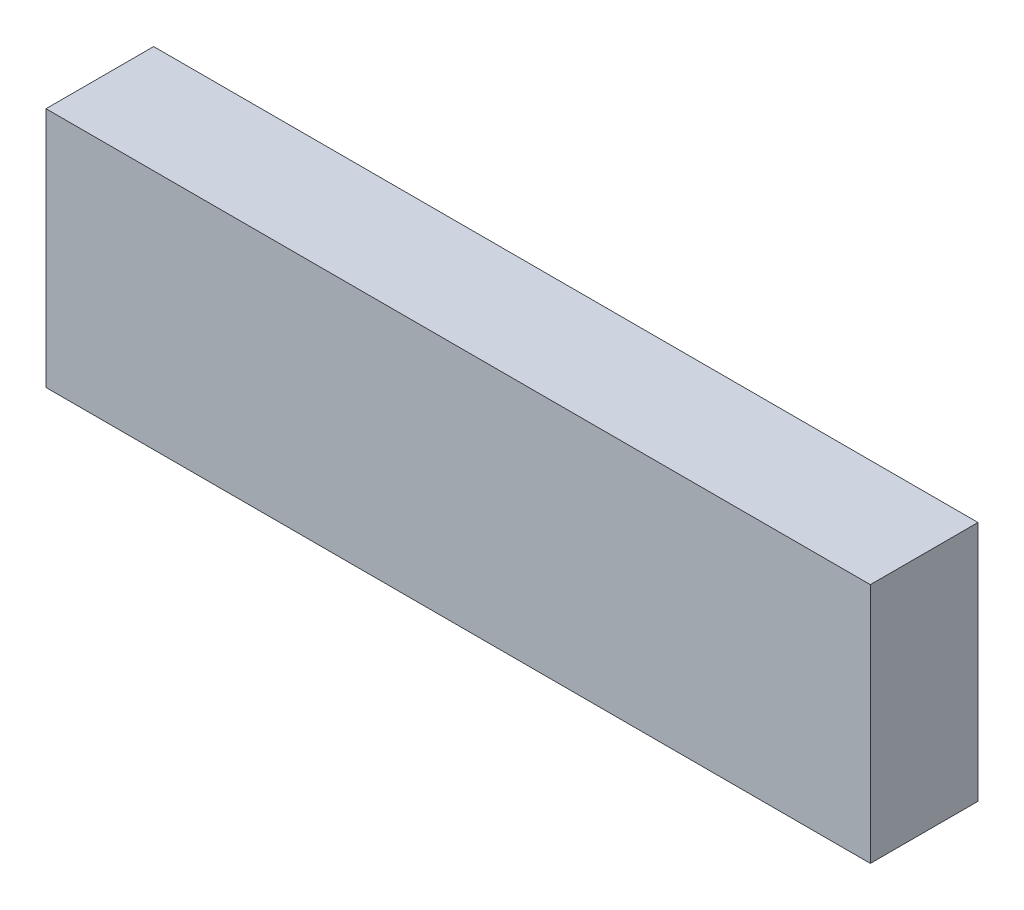
from build123d import *

# Parameters (mm, degrees)
SKETCH1_W           = 268
SKETCH1_H           = 78.5
BOSS_EXTRUDE1_DEPTH = 35


with BuildPart() as part:
    # Sketch1 → Boss-Extrude1 (new body)
    with BuildSketch(Plane.XY):
        with Locations((73.41429038, -19.392759051)):
            Rectangle(SKETCH1_W, SKETCH1_H)
    extrude(amount=BOSS_EXTRUDE1_DEPTH)


solid = part.part
